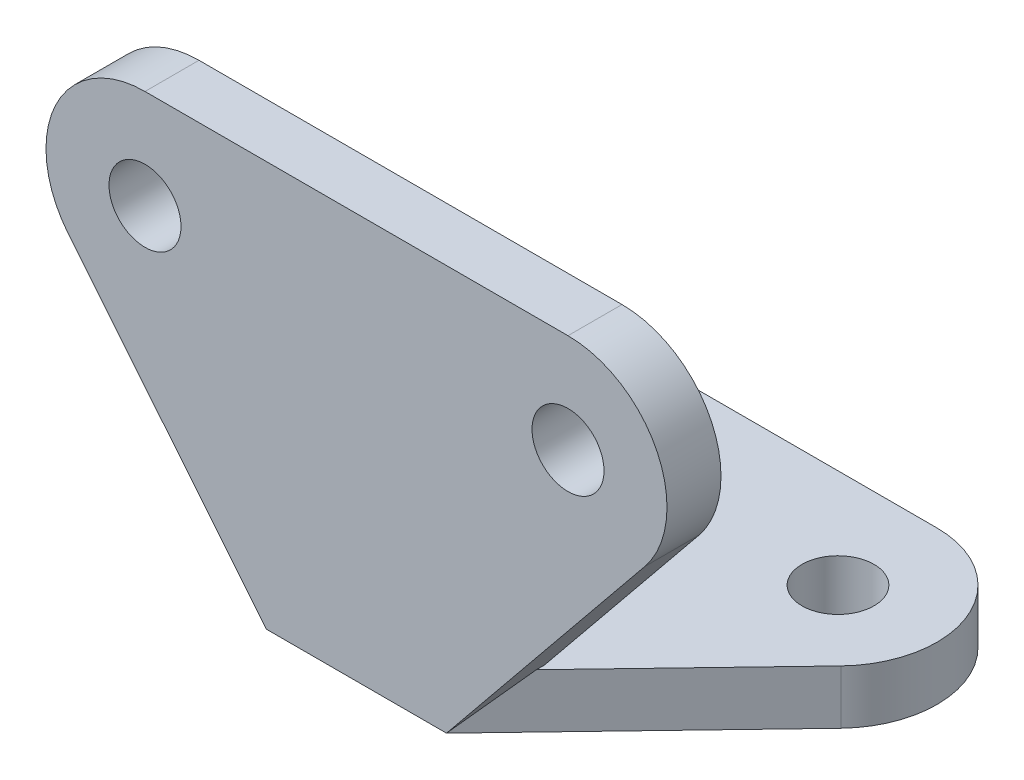
from build123d import *

# Parameters (mm, degrees)
SKETCH_1_R           = 2
EXTRUDE_1_DEPTH      = 3
SKETCH_2_R           = 2
EXTRUDE_2_DEPTH      = 3
EXTRUDE_3_DEPTH      = 5
EXTRUDE_3_DEPTH_BACK = 5
SKETCH_4_R           = 2
CUT_EXTRUDE_1_DEPTH  = 31.046838436


with BuildPart() as part:
    # 草图1 → 凸台-拉伸1 (new body)
    with BuildSketch(Plane(origin=(0, 0, 0), x_dir=(1, 0, 0), z_dir=(0, 1, 0))):
        with BuildLine():
            Line((-11.75, 5.5), (11.75, 5.5))
            ThreePointArc((11.75, 5.5), (16.808303364, 2.159529364), (15.72220169, -3.804157427))
            Line((15.72220169, -3.804157427), (5, -15))
            Line((5, -15), (-5, -15))
            Line((-5, -15), (-15.72220169, -3.804157427))
            ThreePointArc((-15.72220169, -3.804157427), (-16.808303364, 2.159529364), (-11.75, 5.5))
        make_face()
        with Locations((-11.75, 0)):
            Circle(SKETCH_1_R, mode=Mode.SUBTRACT)
        with Locations((11.75, 0)):
            Circle(SKETCH_1_R, mode=Mode.SUBTRACT)
    extrude(amount=EXTRUDE_1_DEPTH)

    # 草图2 → 凸台-拉伸2 (add)
    with BuildSketch(Plane.XY.offset(15)):
        with BuildLine():
            Line((11.75, 22.5), (-11.75, 22.5))
            ThreePointArc((-11.75, 22.5), (-16.717422464, 19.361083239), (-16.014908335, 13.527168749))
            Line((-16.014908335, 13.527168749), (-5, 0))
            Line((-5, 0), (5, 0))
            Line((5, 0), (16.014908335, 13.527168749))
            ThreePointArc((16.014908335, 13.527168749), (16.717422464, 19.361083239), (11.75, 22.5))
        make_face()
        with Locations((11.75, 17)):
            Circle(SKETCH_2_R, mode=Mode.SUBTRACT)
        with Locations((-11.75, 17)):
            Circle(SKETCH_2_R, mode=Mode.SUBTRACT)
    extrude(amount=-EXTRUDE_2_DEPTH)

    # 草图3 → 凸台-拉伸3 (add, two sides: drawn at the far end of the back side and taken through both)
    with BuildSketch(Plane(origin=(0, 0, 0), x_dir=(0, 0, -1), z_dir=(1, 0, 0)).offset(-EXTRUDE_3_DEPTH_BACK)):
        Polygon((-12, 13.527168749), (-3.804157427, 3), (-12, 3), align=None)
    extrude(amount=EXTRUDE_3_DEPTH + EXTRUDE_3_DEPTH_BACK)

    # 草图4 → 切除-拉伸1 (cut, through all)
    with BuildSketch(Plane(origin=(0, 3, 0), x_dir=(1, 0, 0), z_dir=(0, 1, 0))):
        with Locations((0, -7.947430558)):
            Circle(SKETCH_4_R)
    extrude(amount=CUT_EXTRUDE_1_DEPTH, mode=Mode.SUBTRACT)


solid = part.part
